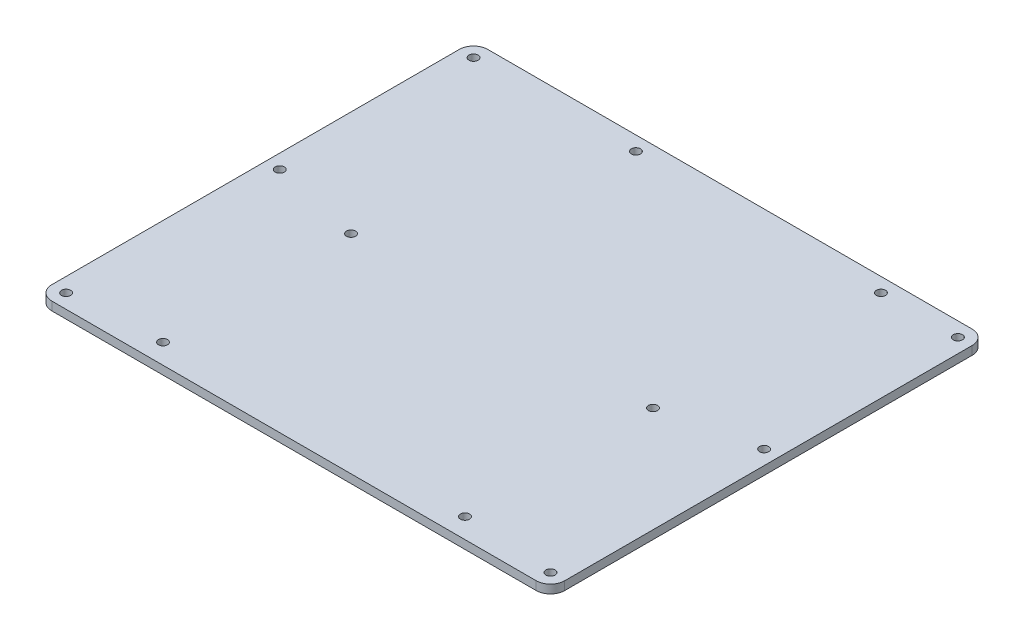
from build123d import *

# Parameters (mm, degrees)
EXTRUDE_1_DEPTH     = 3
CUT_EXTRUDE_1_REACH = 120.158
SKETCH_2_R          = 1.6


with BuildPart() as part:
    # 草图1 → 凸台-拉伸1 (new body)
    with BuildSketch(Plane(origin=(0, 0, 0), x_dir=(1, 0, 0), z_dir=(0, 1, 0))):
        with BuildLine():
            Line((-85, 76.5), (85, 76.5))
            ThreePointArc((85, 76.5), (88.535533906, 75.035533906), (90, 71.5))
            Line((90, 71.5), (90, -71.5))
            ThreePointArc((90, -71.5), (88.535533906, -75.035533906), (85, -76.5))
            Line((85, -76.5), (-85, -76.5))
            ThreePointArc((-85, -76.5), (-88.535533906, -75.035533906), (-90, -71.5))
            Line((-90, -71.5), (-90, 71.5))
            ThreePointArc((-90, 71.5), (-88.535533906, 75.035533906), (-85, 76.5))
        make_face()
    extrude(amount=EXTRUDE_1_DEPTH)

    # 草图2 → 切除-拉伸1 (cut, up to next)
    with BuildSketch(Plane(origin=(0, 3, 0), x_dir=(1, 0, 0), z_dir=(0, 1, 0)), mode=Mode.PRIVATE) as cut_extrude_1_sk1:
        with Locations(Location((-85, 71.5, 0), (0, 0, 270))):
            Circle(SKETCH_2_R)
    cut_extrude_1_tool1 = extrude(cut_extrude_1_sk1.sketch, amount=-CUT_EXTRUDE_1_REACH, mode=Mode.PRIVATE) & part.part
    # 草图2 → 切除-拉伸1 (cut, up to next)
    with BuildSketch(Plane(origin=(0, 3, 0), x_dir=(1, 0, 0), z_dir=(0, 1, 0)), mode=Mode.PRIVATE) as cut_extrude_1_sk2:
        with Locations(Location((85, 71.5, 0), (0, 0, 270))):
            Circle(SKETCH_2_R)
    cut_extrude_1_tool2 = extrude(cut_extrude_1_sk2.sketch, amount=-CUT_EXTRUDE_1_REACH, mode=Mode.PRIVATE) & part.part
    # 草图2 → 切除-拉伸1 (cut, up to next)
    with BuildSketch(Plane(origin=(0, 3, 0), x_dir=(1, 0, 0), z_dir=(0, 1, 0)), mode=Mode.PRIVATE) as cut_extrude_1_sk3:
        with Locations(Location((85, -71.5, 0), (0, 0, 270))):
            Circle(SKETCH_2_R)
    cut_extrude_1_tool3 = extrude(cut_extrude_1_sk3.sketch, amount=-CUT_EXTRUDE_1_REACH, mode=Mode.PRIVATE) & part.part
    # 草图2 → 切除-拉伸1 (cut, up to next)
    with BuildSketch(Plane(origin=(0, 3, 0), x_dir=(1, 0, 0), z_dir=(0, 1, 0)), mode=Mode.PRIVATE) as cut_extrude_1_sk4:
        with Locations(Location((-85, -71.5, 0), (0, 0, 270))):
            Circle(SKETCH_2_R)
    cut_extrude_1_tool4 = extrude(cut_extrude_1_sk4.sketch, amount=-CUT_EXTRUDE_1_REACH, mode=Mode.PRIVATE) & part.part
    # 草图2 → 切除-拉伸1 (cut, up to next)
    with BuildSketch(Plane(origin=(0, 3, 0), x_dir=(1, 0, 0), z_dir=(0, 1, 0)), mode=Mode.PRIVATE) as cut_extrude_1_sk5:
        with Locations(Location((-53, -69.5, 0), (0, 0, 270))):
            Circle(SKETCH_2_R)
    cut_extrude_1_tool5 = extrude(cut_extrude_1_sk5.sketch, amount=-CUT_EXTRUDE_1_REACH, mode=Mode.PRIVATE) & part.part
    # 草图2 → 切除-拉伸1 (cut, up to next)
    with BuildSketch(Plane(origin=(0, 3, 0), x_dir=(1, 0, 0), z_dir=(0, 1, 0)), mode=Mode.PRIVATE) as cut_extrude_1_sk6:
        with Locations(Location((53, -69.5, 0), (0, 0, 270))):
            Circle(SKETCH_2_R)
    cut_extrude_1_tool6 = extrude(cut_extrude_1_sk6.sketch, amount=-CUT_EXTRUDE_1_REACH, mode=Mode.PRIVATE) & part.part
    # 草图2 → 切除-拉伸1 (cut, up to next)
    with BuildSketch(Plane(origin=(0, 3, 0), x_dir=(1, 0, 0), z_dir=(0, 1, 0)), mode=Mode.PRIVATE) as cut_extrude_1_sk7:
        with Locations(Location((53, -3.5, 0), (0, 0, 270))):
            Circle(SKETCH_2_R)
    cut_extrude_1_tool7 = extrude(cut_extrude_1_sk7.sketch, amount=-CUT_EXTRUDE_1_REACH, mode=Mode.PRIVATE) & part.part
    # 草图2 → 切除-拉伸1 (cut, up to next)
    with BuildSketch(Plane(origin=(0, 3, 0), x_dir=(1, 0, 0), z_dir=(0, 1, 0)), mode=Mode.PRIVATE) as cut_extrude_1_sk8:
        with Locations(Location((-53, -3.5, 0), (0, 0, 270))):
            Circle(SKETCH_2_R)
    cut_extrude_1_tool8 = extrude(cut_extrude_1_sk8.sketch, amount=-CUT_EXTRUDE_1_REACH, mode=Mode.PRIVATE) & part.part
    # 草图2 → 切除-拉伸1 (cut, up to next)
    with BuildSketch(Plane(origin=(0, 3, 0), x_dir=(1, 0, 0), z_dir=(0, 1, 0)), mode=Mode.PRIVATE) as cut_extrude_1_sk9:
        with Locations(Location((-28, 71.5, 0), (0, 0, 270))):
            Circle(SKETCH_2_R)
    cut_extrude_1_tool9 = extrude(cut_extrude_1_sk9.sketch, amount=-CUT_EXTRUDE_1_REACH, mode=Mode.PRIVATE) & part.part
    # 草图2 → 切除-拉伸1 (cut, up to next)
    with BuildSketch(Plane(origin=(0, 3, 0), x_dir=(1, 0, 0), z_dir=(0, 1, 0)), mode=Mode.PRIVATE) as cut_extrude_1_sk10:
        with Locations(Location((58, 71.5, 0), (0, 0, 270))):
            Circle(SKETCH_2_R)
    cut_extrude_1_tool10 = extrude(cut_extrude_1_sk10.sketch, amount=-CUT_EXTRUDE_1_REACH, mode=Mode.PRIVATE) & part.part
    # 草图2 → 切除-拉伸1 (cut, up to next)
    with BuildSketch(Plane(origin=(0, 3, 0), x_dir=(1, 0, 0), z_dir=(0, 1, 0)), mode=Mode.PRIVATE) as cut_extrude_1_sk11:
        with Locations(Location((-85, 3.5, 0), (0, 0, 270))):
            Circle(SKETCH_2_R)
    cut_extrude_1_tool11 = extrude(cut_extrude_1_sk11.sketch, amount=-CUT_EXTRUDE_1_REACH, mode=Mode.PRIVATE) & part.part
    # 草图2 → 切除-拉伸1 (cut, up to next)
    with BuildSketch(Plane(origin=(0, 3, 0), x_dir=(1, 0, 0), z_dir=(0, 1, 0)), mode=Mode.PRIVATE) as cut_extrude_1_sk12:
        with Locations(Location((85, 3.5, 0), (0, 0, 270))):
            Circle(SKETCH_2_R)
    cut_extrude_1_tool12 = extrude(cut_extrude_1_sk12.sketch, amount=-CUT_EXTRUDE_1_REACH, mode=Mode.PRIVATE) & part.part
    add(cut_extrude_1_tool1.solids().sort_by_distance((-85, 3, -71.5))[0], mode=Mode.SUBTRACT)
    add(cut_extrude_1_tool2.solids().sort_by_distance((85, 3, -71.5))[0], mode=Mode.SUBTRACT)
    add(cut_extrude_1_tool3.solids().sort_by_distance((85, 3, 71.5))[0], mode=Mode.SUBTRACT)
    add(cut_extrude_1_tool4.solids().sort_by_distance((-85, 3, 71.5))[0], mode=Mode.SUBTRACT)
    add(cut_extrude_1_tool5.solids().sort_by_distance((-53, 3, 69.5))[0], mode=Mode.SUBTRACT)
    add(cut_extrude_1_tool6.solids().sort_by_distance((53, 3, 69.5))[0], mode=Mode.SUBTRACT)
    add(cut_extrude_1_tool7.solids().sort_by_distance((53, 3, 3.5))[0], mode=Mode.SUBTRACT)
    add(cut_extrude_1_tool8.solids().sort_by_distance((-53, 3, 3.5))[0], mode=Mode.SUBTRACT)
    add(cut_extrude_1_tool9.solids().sort_by_distance((-28, 3, -71.5))[0], mode=Mode.SUBTRACT)
    add(cut_extrude_1_tool10.solids().sort_by_distance((58, 3, -71.5))[0], mode=Mode.SUBTRACT)
    add(cut_extrude_1_tool11.solids().sort_by_distance((-85, 3, -3.5))[0], mode=Mode.SUBTRACT)
    add(cut_extrude_1_tool12.solids().sort_by_distance((85, 3, -3.5))[0], mode=Mode.SUBTRACT)


solid = part.part
